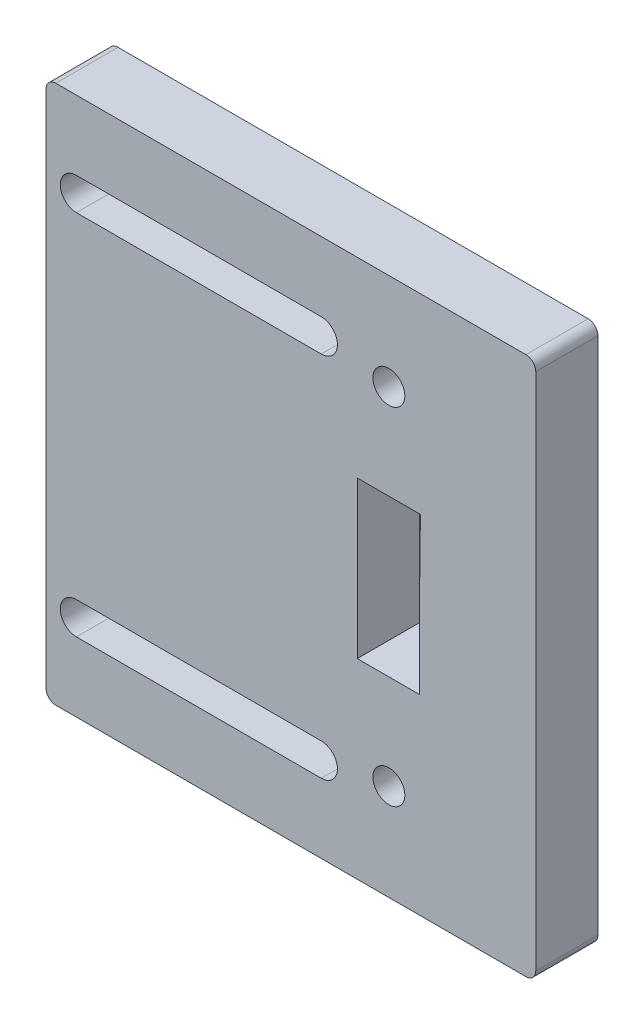
from build123d import *

# Parameters (mm, degrees)
SKETCH1_W                                        = 100
SKETCH1_H                                        = 110
BOSS_EXTRUDE2_DEPTH                              = 12.7
CSK_FOR_1_4_FLAT_HEAD_MACHINE_SCREW3_D           = 6.5278
CSK_FOR_1_4_FLAT_HEAD_MACHINE_SCREW3_CSINK_D     = 12.8778
CSK_FOR_1_4_FLAT_HEAD_MACHINE_SCREW3_CSINK_ANGLE = 82
CSK_FOR_1_4_FLAT_HEAD_MACHINE_SCREW4_D           = 6.5278
CSK_FOR_1_4_FLAT_HEAD_MACHINE_SCREW4_CSINK_D     = 12.8778
CSK_FOR_1_4_FLAT_HEAD_MACHINE_SCREW4_CSINK_ANGLE = 82
FILLET1_R                                        = 2
CUT_EXTRUDE1_DEPTH                               = 150.202178268


with BuildPart() as part:
    # Sketch1 → Boss-Extrude2 (new body)
    with BuildSketch(Plane.XY):
        with Locations((50, -55)):
            Rectangle(SKETCH1_W, SKETCH1_H)
        Polygon((70, -39.025625978), (76.45, -39.025625978), (76.25, -55), (76.25, -70.975625978), (70, -70.975625978), (63.55, -70.975625978), (63.55, -39.025625978), align=None, mode=Mode.SUBTRACT)
    extrude(amount=BOSS_EXTRUDE2_DEPTH)

    # CSK for 1/4 Flat Head Machine Screw3 (through all)
    with Locations(Plane(origin=(0, 0, 0), x_dir=(-1, 0, 0), z_dir=(0, 0, -1))):
        with Locations((-70, -90.31)):
            CounterSinkHole(CSK_FOR_1_4_FLAT_HEAD_MACHINE_SCREW3_D / 2, CSK_FOR_1_4_FLAT_HEAD_MACHINE_SCREW3_CSINK_D / 2, counter_sink_angle=CSK_FOR_1_4_FLAT_HEAD_MACHINE_SCREW3_CSINK_ANGLE)

    # CSK for 1/4 Flat Head Machine Screw4 (through all)
    with Locations(Plane(origin=(0, 0, 0), x_dir=(-1, 0, 0), z_dir=(0, 0, -1))):
        with Locations((-70, -19.69)):
            CounterSinkHole(CSK_FOR_1_4_FLAT_HEAD_MACHINE_SCREW4_D / 2, CSK_FOR_1_4_FLAT_HEAD_MACHINE_SCREW4_CSINK_D / 2, counter_sink_angle=CSK_FOR_1_4_FLAT_HEAD_MACHINE_SCREW4_CSINK_ANGLE)

    # Fillet1
    fillet1_edges = [part.edges().sort_by_distance(p)[0] for p in [
        (0, 0, 6.35),
        (100, 0, 6.35),
        (100, -110, 6.35),
        (0, -110, 6.35),
    ]]
    fillet(fillet1_edges, radius=FILLET1_R)

    # Sketch15 → Cut-Extrude1 (cut, through all)
    with BuildSketch(Plane(origin=(0, 0, 0), x_dir=(-1, 0, 0), z_dir=(0, 0, -1))):
        with BuildLine():
            Line((-56.200253658, -14.19), (-6.200253658, -14.19))
            ThreePointArc((-6.200253658, -14.19), (-2.900253658, -17.49), (-6.200253658, -20.79))
            Line((-6.200253658, -20.79), (-56.200253658, -20.79))
            ThreePointArc((-56.200253658, -20.79), (-59.500253658, -17.49), (-56.200253658, -14.19))
        make_face()
        with BuildLine():
            Line((-56.200253658, -89.21), (-6.200253658, -89.21))
            ThreePointArc((-6.200253658, -89.21), (-2.900253658, -92.51), (-6.200253658, -95.81))
            Line((-6.200253658, -95.81), (-56.200253658, -95.81))
            ThreePointArc((-56.200253658, -95.81), (-59.500253658, -92.51), (-56.200253658, -89.21))
        make_face()
    extrude(amount=-CUT_EXTRUDE1_DEPTH, mode=Mode.SUBTRACT)


solid = part.part
